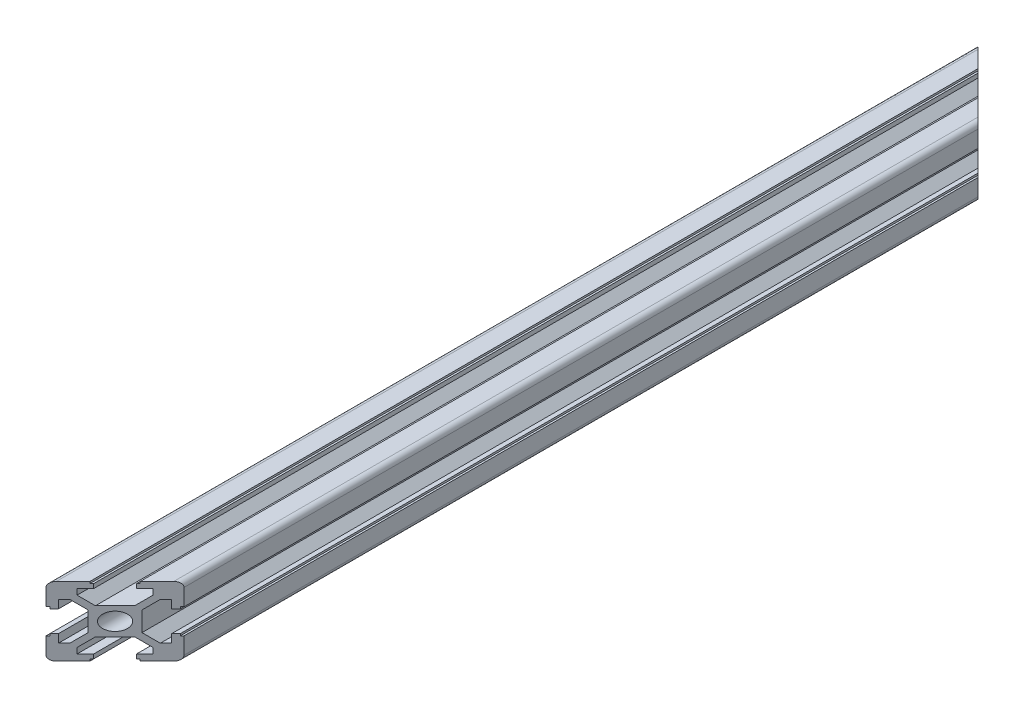
from build123d import *

# Parameters (mm, degrees)
SKETCH_2_R          = 2.55
EXTRUDE_1_DEPTH     = 270
CUT_EXTRUDE_1_DEPTH = 38


with BuildPart() as part:
    # 草图2 → 凸台-拉伸1 (new body)
    with BuildSketch(Plane.XY):
        with BuildLine():
            Line((-3.9, 2.839339828), (-6.560660172, 5.5))
            Line((-6.560660172, 5.5), (-8.2, 5.5))
            Line((-8.2, 5.5), (-8.2, 3.1))
            Line((-8.2, 3.1), (-9.45, 3.1))
            Line((-9.45, 3.1), (-9.45, 3.65))
            Line((-9.45, 3.65), (-10, 3.65))
            Line((-10, 3.65), (-10, 8.5))
            ThreePointArc((-10, 8.5), (-9.560660172, 9.560660172), (-8.5, 10))
            Line((-8.5, 10), (-3.65, 10))
            Line((-3.65, 10), (-3.65, 9.45))
            Line((-3.65, 9.45), (-3.1, 9.45))
            Line((-3.1, 9.45), (-3.1, 8.2))
            Line((-3.1, 8.2), (-5.5, 8.2))
            Line((-5.5, 8.2), (-5.5, 6.560660172))
            Line((-5.5, 6.560660172), (-2.839339828, 3.9))
            Line((-2.839339828, 3.9), (2.839339828, 3.9))
            Line((2.839339828, 3.9), (5.5, 6.560660172))
            Line((5.5, 6.560660172), (5.5, 8.2))
            Line((5.5, 8.2), (3.1, 8.2))
            Line((3.1, 8.2), (3.1, 9.45))
            Line((3.1, 9.45), (3.65, 9.45))
            Line((3.65, 9.45), (3.65, 10))
            Line((3.65, 10), (8.5, 10))
            ThreePointArc((8.5, 10), (9.560660172, 9.560660172), (10, 8.5))
            Line((10, 8.5), (10, 3.65))
            Line((10, 3.65), (9.45, 3.65))
            Line((9.45, 3.65), (9.45, 3.1))
            Line((9.45, 3.1), (8.2, 3.1))
            Line((8.2, 3.1), (8.2, 5.5))
            Line((8.2, 5.5), (6.560660172, 5.5))
            Line((6.560660172, 5.5), (3.9, 2.839339828))
            Line((3.9, 2.839339828), (3.9, -2.839339828))
            Line((3.9, -2.839339828), (6.560660172, -5.5))
            Line((6.560660172, -5.5), (8.2, -5.5))
            Line((8.2, -5.5), (8.2, -3.1))
            Line((8.2, -3.1), (9.45, -3.1))
            Line((9.45, -3.1), (9.45, -3.65))
            Line((9.45, -3.65), (10, -3.65))
            Line((10, -3.65), (10, -8.5))
            ThreePointArc((10, -8.5), (9.560660172, -9.560660172), (8.5, -10))
            Line((8.5, -10), (3.65, -10))
            Line((3.65, -10), (3.65, -9.45))
            Line((3.65, -9.45), (3.1, -9.45))
            Line((3.1, -9.45), (3.1, -8.2))
            Line((3.1, -8.2), (5.5, -8.2))
            Line((5.5, -8.2), (5.5, -6.560660172))
            Line((5.5, -6.560660172), (2.839339828, -3.9))
            Line((2.839339828, -3.9), (-2.839339828, -3.9))
            Line((-2.839339828, -3.9), (-5.5, -6.560660172))
            Line((-5.5, -6.560660172), (-5.5, -8.2))
            Line((-5.5, -8.2), (-3.1, -8.2))
            Line((-3.1, -8.2), (-3.1, -9.45))
            Line((-3.1, -9.45), (-3.65, -9.45))
            Line((-3.65, -9.45), (-3.65, -10))
            Line((-3.65, -10), (-8.5, -10))
            ThreePointArc((-8.5, -10), (-9.560660172, -9.560660172), (-10, -8.5))
            Line((-10, -8.5), (-10, -3.65))
            Line((-10, -3.65), (-9.45, -3.65))
            Line((-9.45, -3.65), (-9.45, -3.1))
            Line((-9.45, -3.1), (-8.2, -3.1))
            Line((-8.2, -3.1), (-8.2, -5.5))
            Line((-8.2, -5.5), (-6.560660172, -5.5))
            Line((-6.560660172, -5.5), (-3.9, -2.839339828))
            Line((-3.9, -2.839339828), (-3.9, 2.839339828))
        make_face()
        Circle(SKETCH_2_R, mode=Mode.SUBTRACT)
    extrude(amount=EXTRUDE_1_DEPTH)

    # 草图3 → 切除-拉伸1 (cut)
    with BuildSketch(Plane(origin=(0, 10, 0), x_dir=(1, 0, 0), z_dir=(0, 1, 0))):
        Polygon((-10, 0), (10, -20), (10, 0), align=None)
        Polygon((-10, -270), (10, -250), (10, -270), align=None)
    extrude(amount=-CUT_EXTRUDE_1_DEPTH, mode=Mode.SUBTRACT)


solid = part.part
